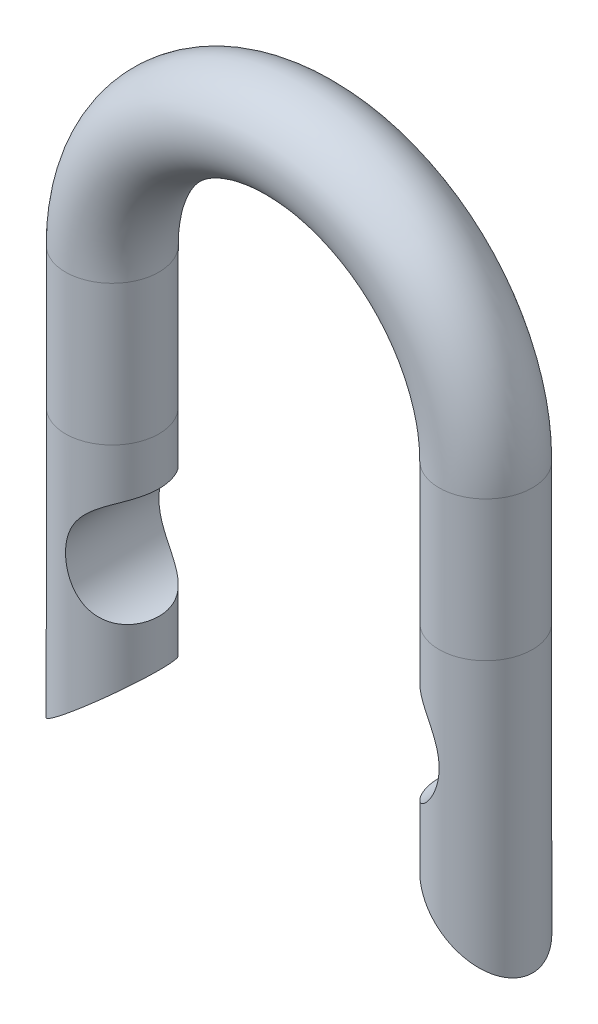
from build123d import *

# Parameters (mm, degrees)
SWEEP1_PROFILE_R        = 5
CUT_EXTRUDE1_DEPTH      = 61.415230017
CUT_EXTRUDE1_DEPTH_BACK = 61.415230017
CUT_EXTRUDE3_DEPTH      = 61.415230017
CUT_EXTRUDE3_DEPTH_BACK = 61.415230017


with BuildPart() as part:
    # Sweep1: sweep along a path in Sketch2
    with BuildLine(Plane.XY) as sweep1_path:
        Line((40, -30), (40, 0))
        Line((40, 0), (40, 15))
        ThreePointArc((40, 15), (20, 35), (0, 15))
        Line((0, 15), (0, 0))
        Line((0, 0), (0, -30))
    # Sweep1 profile (on start of the path) → Sweep1 (sweep)
    with BuildSketch(Plane(origin=(40, -30, 0), x_dir=(1, 0, 0), z_dir=(0, 1, 0))):
        Circle(SWEEP1_PROFILE_R)
    sweep(path=sweep1_path.line)

    # Sketch14 → Cut-Extrude1 (cut, two sides: drawn at the far end of the back side and taken through both)
    with BuildSketch(Plane.XY.offset(-CUT_EXTRUDE1_DEPTH_BACK)):
        with BuildLine():
            Line((6, -5), (34, -5))
            ThreePointArc((34, -5), (40, -11), (34, -17))
            Line((34, -17), (6, -17))
            ThreePointArc((6, -17), (0, -11), (6, -5))
        make_face()
    extrude(amount=CUT_EXTRUDE1_DEPTH + CUT_EXTRUDE1_DEPTH_BACK, mode=Mode.SUBTRACT)

    # Sketch22 → Cut-Extrude3 (cut, two sides: drawn at the far end of the back side and taken through both)
    with BuildSketch(Plane.XY.offset(-CUT_EXTRUDE3_DEPTH_BACK)):
        Polygon((-5, -30), (5, -21.916079783), (5, -30), align=None)
        Polygon((35, -30), (45, -30), (35, -21.916079783), align=None)
    extrude(amount=CUT_EXTRUDE3_DEPTH + CUT_EXTRUDE3_DEPTH_BACK, mode=Mode.SUBTRACT)


solid = part.part
